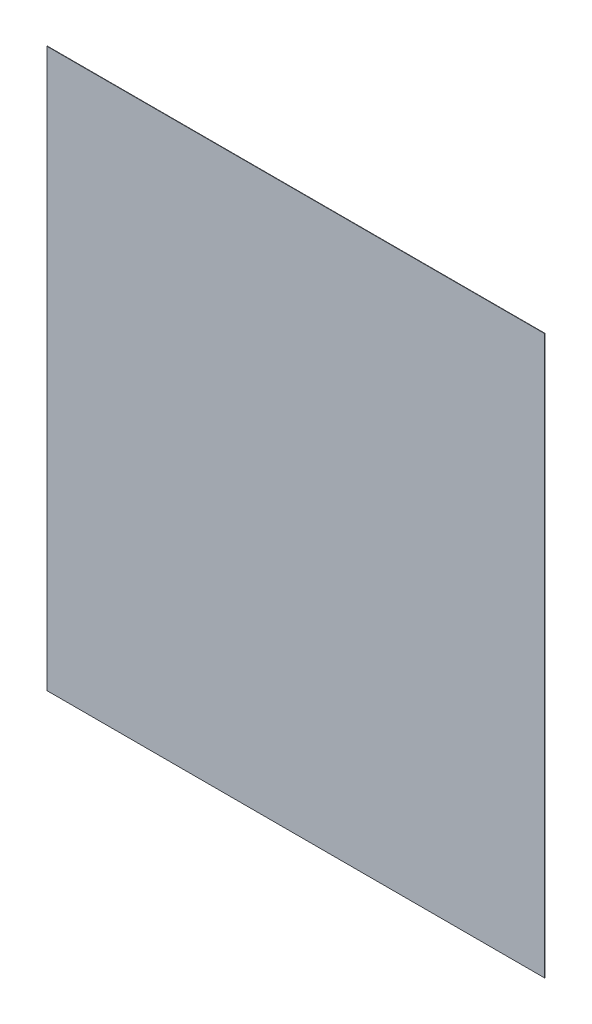
from build123d import *

# Parameters (mm, degrees)
STORE_IC_ARKA_1_START = -757.5
SKETCH1_W             = 1275
SKETCH1_H             = 1429.5
STORE_IC_ARKA_1_DEPTH = 1


with BuildPart() as part:
    # Sketch1 → STORE_ic_arka_1 (new body)
    with BuildSketch(Plane.XY.offset(STORE_IC_ARKA_1_START)):
        with Locations((700, 896.25)):
            Rectangle(SKETCH1_W, SKETCH1_H)
    extrude(amount=-STORE_IC_ARKA_1_DEPTH)


solid = part.part
